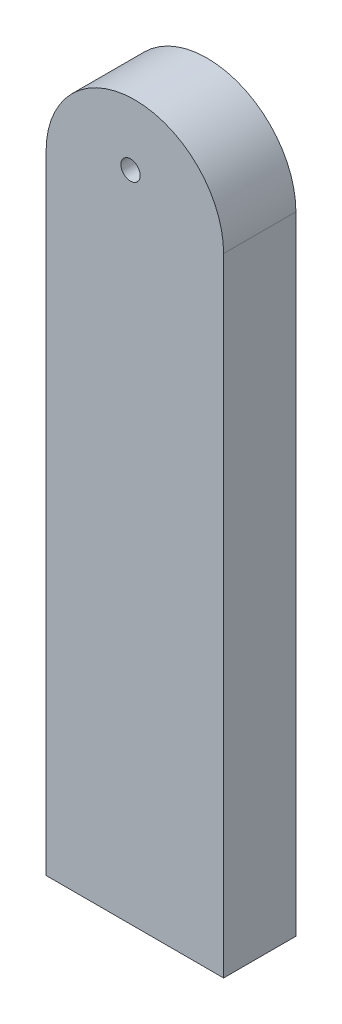
from build123d import *

# Parameters (mm, degrees)
RESSALTO_EXTRUS_O1_DEPTH = 14.98
ESBO_O2_R                = 2
CORTE_EXTRUS_O1_DEPTH    = 62.5


with BuildPart() as part:
    # Esboço1 → Ressalto-extrusão1 (new body)
    with BuildSketch(Plane.XY):
        with BuildLine():
            Line((-17.493550541, 31.212986182), (-17.493550541, -98.787013818))
            Line((-17.493550541, -98.787013818), (19.286449459, -98.787013818))
            Line((19.286449459, -98.787013818), (19.286449459, 31.212986182))
            ThreePointArc((19.286449459, 31.212986182), (0.896449459, 49.602986182), (-17.493550541, 31.212986182))
        make_face()
    extrude(amount=RESSALTO_EXTRUS_O1_DEPTH)

    # Esboço2 → Corte-extrusão1 (cut, symmetric)
    with BuildSketch(Plane.XY.offset(14.98)):
        with Locations(Location((0, 36.56215444, 0), (0, 0, 180))):
            Circle(ESBO_O2_R)
    extrude(amount=CORTE_EXTRUS_O1_DEPTH, both=True, mode=Mode.SUBTRACT)


solid = part.part
